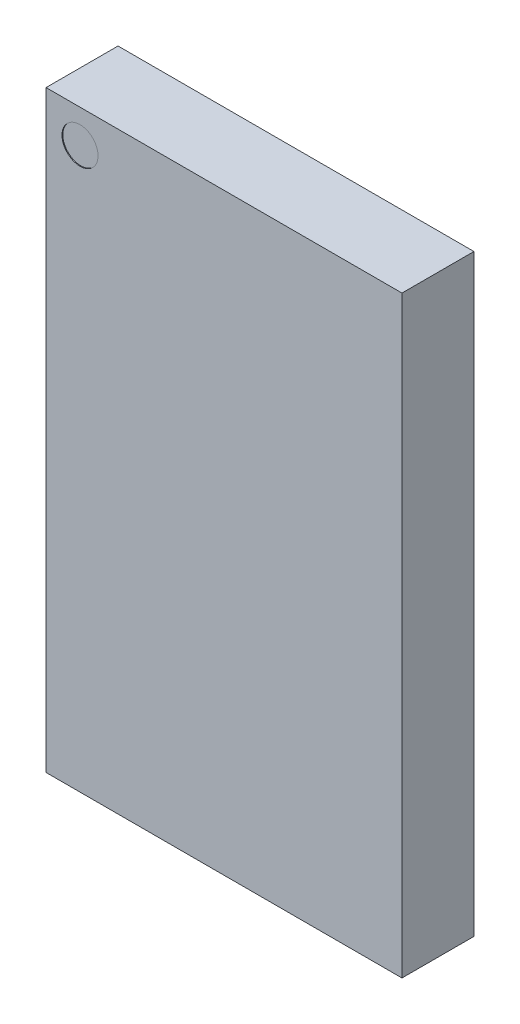
from build123d import *

# Parameters (mm, degrees)
BOSS_EXTRUDE1_START  = 0.4
SKETCH1_W            = 9
SKETCH1_H            = 15
BOSS_EXTRUDE1_DEPTH  = 1.82
LPATTERN1_COUNT      = 11
LPATTERN1_PITCH      = 1.27
LPATTERN1_COUNT_DIR2 = 7
LPATTERN1_PITCH_DIR2 = 1.27
SKETCH3_R            = 0.455605471
CUT_EXTRUDE1_DEPTH   = 0.02


with BuildPart() as part:
    # Sketch1 → Boss-Extrude1 (new body)
    with BuildSketch(Plane.XY.offset(BOSS_EXTRUDE1_START)):
        Rectangle(SKETCH1_W, SKETCH1_H)
    extrude(amount=BOSS_EXTRUDE1_DEPTH)

    # Sketch2 → Revolve1 (revolve)
    with BuildSketch(Plane(origin=(0, -6.35, 0), x_dir=(-1, 0, 0), z_dir=(0, -1, 0))):
        with BuildLine():
            Line((3.81, -0.53), (3.81, 0.1))
            ThreePointArc((3.81, 0.1), (4.125, -0.215), (3.81, -0.53))
        make_face()
    revolve1 = revolve(axis=Axis((-3.81, -6.35, 0.53), (0, 0, -1)))

    # LPattern1: Revolve1 11 × 7
    with Locations(*[(j * LPATTERN1_PITCH_DIR2, i * LPATTERN1_PITCH, 0) for i in range(LPATTERN1_COUNT) for j in range(LPATTERN1_COUNT_DIR2) if (i, j) != (0, 0)]):
        add(revolve1)

    # Sketch3 → Cut-Extrude1 (cut)
    with BuildSketch(Plane.XY.offset(2.22)):
        with Locations((-3.641084257, 6.661529152)):
            Circle(SKETCH3_R)
    extrude(amount=-CUT_EXTRUDE1_DEPTH, mode=Mode.SUBTRACT)


solid = part.part
